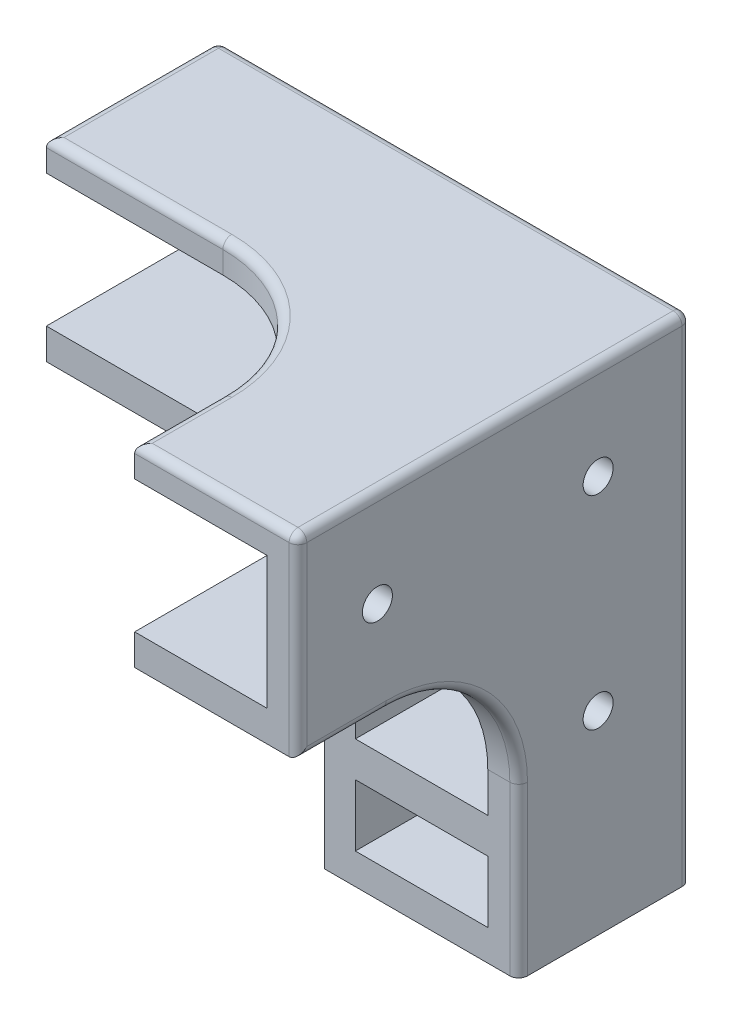
from build123d import *

# Parameters (mm, degrees)
BOSS_EXTRUDE1_DEPTH = 19.5
SKETCH3_W           = 18.5
SKETCH3_H           = 22
BOSS_EXTRUDE2_DEPTH = 25
SKETCH5_W           = 50
SKETCH5_H           = 15
SKETCH5_W_2         = 15
SKETCH5_H_2         = 7
CUT_EXTRUDE1_DEPTH  = 40.5
BOSS_EXTRUDE4_DEPTH = 3.5
BOSS_EXTRUDE5_DEPTH = 3.5
BOSS_EXTRUDE6_DEPTH = 3.5
FILLET3_R           = 3
CUT_EXTRUDE3_DEPTH  = 1
SKETCH12_R          = 1.7
CUT_EXTRUDE4_DEPTH  = 5
SKETCH13_R          = 1.7
CUT_EXTRUDE5_DEPTH  = 45
SKETCH14_R          = 1.7
CUT_EXTRUDE6_DEPTH  = 45
SKETCH15_R          = 1.7
CUT_EXTRUDE7_DEPTH  = 4
FILLET4_R           = 1


with BuildPart() as part:
    # Sketch1 → Boss-Extrude1 (new body)
    with BuildSketch(Plane.XY):
        Polygon((-5.699410772, 32.916253451), (16.300589228, 32.916253451), (16.300589228, -23.083746549), (-5.699410772, -23.083746549), (-5.699410772, 10.916253451), (-37.199410772, 10.916253451), (-37.199410772, 32.916253451), align=None)
    extrude(amount=BOSS_EXTRUDE1_DEPTH)

    # Sketch3 → Boss-Extrude2 (add)
    with BuildSketch(Plane.XY.offset(19.5)):
        with Locations((7.050589228, 21.916253451)):
            Rectangle(SKETCH3_W, SKETCH3_H)
    extrude(amount=BOSS_EXTRUDE2_DEPTH)

    # Sketch5 → Cut-Extrude1 (cut)
    with BuildSketch(Plane.XY.offset(44.5)):
        with Locations((-12.199410772, 21.916253451)):
            Rectangle(SKETCH5_W, SKETCH5_H)
        with Locations((5.300589228, -1.083746549)):
            Rectangle(SKETCH5_W_2, SKETCH5_H)
        with Locations((5.300589228, -16.083746549)):
            Rectangle(SKETCH5_W_2, SKETCH5_H_2)
    extrude(amount=-CUT_EXTRUDE1_DEPTH, mode=Mode.SUBTRACT)

    # Sketch7 → Boss-Extrude4 (add)
    with BuildSketch(Plane(origin=(16.300589228, 0, 0), x_dir=(0, 0, -1), z_dir=(1, 0, 0))):
        with BuildLine():
            Line((-34.5, 10.916253451), (-19.5, 10.916253451))
            Line((-19.5, 10.916253451), (-19.5, -4.083746549))
            ThreePointArc((-19.5, -4.083746549), (-23.893398282, 6.522855169), (-34.5, 10.916253451))
        make_face()
    extrude(amount=-BOSS_EXTRUDE4_DEPTH)

    # Sketch8 → Boss-Extrude5 (add)
    with BuildSketch(Plane(origin=(0, 0, 0), x_dir=(-1, 0, 0), z_dir=(0, 0, -1))):
        with BuildLine():
            Line((5.699410772, 10.916253451), (20.699410772, 10.916253451))
            ThreePointArc((20.699410772, 10.916253451), (10.092809055, 6.522855169), (5.699410772, -4.083746549))
            Line((5.699410772, -4.083746549), (5.699410772, 10.916253451))
        make_face()
    extrude(amount=-BOSS_EXTRUDE5_DEPTH)

    # Sketch9 → Boss-Extrude6 (add)
    with BuildSketch(Plane(origin=(0, 32.916253451, 0), x_dir=(1, 0, 0), z_dir=(0, 1, 0))):
        with BuildLine():
            Line((-2.199410772, -34.5), (-2.199410772, -19.5))
            Line((-2.199410772, -19.5), (-17.199410772, -19.5))
            ThreePointArc((-17.199410772, -19.5), (-6.592809055, -23.893398282), (-2.199410772, -34.5))
        make_face()
    extrude(amount=-BOSS_EXTRUDE6_DEPTH)

    # Fillet3
    fillet3_edges = [part.edges().sort_by_distance(p)[0] for p in [
        (-2.199410772, 12.666253451, 19.5),
    ]]
    fillet(fillet3_edges, radius=FILLET3_R)

    # Sketch11 → Cut-Extrude3 (cut)
    # profile 1 of 4: a face of its own
    with BuildSketch(Plane(origin=(0, 0, 0), x_dir=(-1, 0, 0), z_dir=(0, 0, -1))):
        Polygon((-10.800589228, -18.789996549), (-10.800589228, -16.838073472), (-2.43039692, -14.652977318), (-10.800589228, -12.463073472), (-10.800589228, -10.515958087), (1.199410772, -8.729900395), (1.199410772, -10.602496549), (-6.379916151, -11.729900395), (1.199410772, -13.715477318), (1.199410772, -15.597688857), (-6.379916151, -17.576054241), (1.199410772, -18.703458087), (1.199410772, -20.576054241), align=None)
    # profile 2 of 4: a face of its own
    with BuildSketch(Plane(origin=(0, 0, 0), x_dir=(-1, 0, 0), z_dir=(0, 0, -1))):
        with BuildLine():
            Line((-10.800589228, -7.991438857), (-10.800589228, -5.952977318))
            add(Edge.make_bspline(
                [(-10.800589228, -5.952977318), (-10.800005012, -5.818337024), (-10.798881276, -5.559357226), (-10.780939362, -5.185841664), (-10.756194453, -4.841644627), (-10.717588986, -4.528141475), (-10.670910939, -4.244422827), (-10.610297955, -3.991812577), (-10.542991354, -3.767135176), (-10.432899575, -3.510089545), (-10.261344606, -3.2204116), (-9.993854575, -2.916502166), (-9.674999978, -2.642644015), (-9.298421338, -2.412342144), (-8.876833149, -2.221736808), (-8.412796045, -2.089022583), (-7.914245505, -2.00467731), (-7.569376461, -1.995936272), (-7.391935381, -1.991438857)],
                knots=[0, 0, 0, 0, 1.067446855, 2.053227611, 2.964447842, 3.802928181, 4.55705831, 5.242813606, 5.861740442, 6.41401137, 7.456762865, 8.515266784, 9.610284097, 10.777391769, 12.003071174, 13.267653188, 14.594160368, 16, 16, 16, 16], degree=3))
            add(Edge.make_bspline(
                [(-7.391935381, -1.991438857), (-7.297355032, -1.992855248), (-7.111944506, -1.99563187), (-6.839545611, -2.016474255), (-6.57922187, -2.056818659), (-6.329385024, -2.104637483), (-6.092864844, -2.173393793), (-5.86736032, -2.254741183), (-5.654862929, -2.353204183), (-5.453365078, -2.465039747), (-5.262464902, -2.588608019), (-5.086843378, -2.732896484), (-4.9205107, -2.888692529), (-4.766123648, -3.059365613), (-4.626046251, -3.246963608), (-4.496602326, -3.448494847), (-4.377999142, -3.665222723), (-4.310704173, -3.817832702), (-4.276550766, -3.895285011)],
                knots=[0, 0, 0, 0, 1.163181294, 2.28024169, 3.356120165, 4.401649984, 5.406013808, 6.381787017, 7.347406326, 8.282525473, 9.21452408, 10.139462981, 11.073595085, 12.01554303, 12.965498088, 13.949545959, 14.959357709, 16, 16, 16, 16], degree=3))
            Line((-4.276550766, -3.895285011), (1.199410772, -1.452977318))
            Line((1.199410772, -1.452977318), (1.199410772, -3.541919626))
            Line((1.199410772, -3.541919626), (-4.031358458, -5.873650395))
            Line((-4.031358458, -5.873650395), (-4.031358458, -6.145285011))
            Line((-4.031358458, -6.145285011), (1.199410772, -6.145285011))
            Line((1.199410772, -6.145285011), (1.199410772, -7.991438857))
            Line((1.199410772, -7.991438857), (-10.800589228, -7.991438857))
        make_face()
        with BuildLine():
            Line((-6.185204612, -6.145285011), (-6.185204612, -5.515477318))
            add(Edge.make_bspline(
                [(-6.185204612, -5.515477318), (-6.186367141, -5.438550003), (-6.188596807, -5.291007573), (-6.198784481, -5.078941418), (-6.223636793, -4.886497292), (-6.255016899, -4.712471663), (-6.291026717, -4.555276318), (-6.342625913, -4.418389599), (-6.399049431, -4.298462814), (-6.489896288, -4.166118437), (-6.633796999, -4.027471922), (-6.856716063, -3.91397639), (-7.124487444, -3.84724369), (-7.317795964, -3.840947182), (-7.420781535, -3.837592703)],
                knots=[0, 0, 0, 0, 1.14443165, 2.194958024, 3.155864406, 4.02787753, 4.825710302, 5.549708663, 6.200008757, 6.791751392, 7.929772656, 9.129352395, 10.470655706, 12, 12, 12, 12], degree=3))
            add(Edge.make_bspline(
                [(-7.420781535, -3.837592703), (-7.484265153, -3.839856392), (-7.607360624, -3.844245712), (-7.785755229, -3.879686188), (-7.952879051, -3.933201989), (-8.103735349, -4.014031264), (-8.239800846, -4.109799367), (-8.356212547, -4.223260262), (-8.450592564, -4.353040951), (-8.531146795, -4.502587927), (-8.586059735, -4.694350085), (-8.620716321, -4.939833657), (-8.644326337, -5.246603017), (-8.645891807, -5.472154526), (-8.646743074, -5.594804241)],
                knots=[0, 0, 0, 0, 0.9241003, 1.791841178, 2.640927318, 3.471185814, 4.274581995, 5.058835706, 5.827024317, 6.605084504, 7.520888769, 8.714677486, 10.213517293, 12, 12, 12, 12], degree=3))
            Line((-8.646743074, -5.594804241), (-8.646743074, -6.145285011))
            Line((-8.646743074, -6.145285011), (-6.185204612, -6.145285011))
        make_face(mode=Mode.SUBTRACT)
    # profile 3 of 4: a face of its own
    with BuildSketch(Plane(origin=(0, 0, 0), x_dir=(-1, 0, 0), z_dir=(0, 0, -1))):
        with BuildLine():
            add(Edge.make_bspline(
                [(-1.262127689, -0.176054241), (-1.257647984, -0.104101941), (-1.248753835, 0.038754448), (-1.172545764, 0.242235867), (-1.05033496, 0.427832621), (-0.88404186, 0.590235666), (-0.687299125, 0.730105266), (-0.462023761, 0.828247267), (-0.217504351, 0.891566147), (-0.046993635, 0.897708021), (0.040756926, 0.900868836)],
                knots=[0, 0, 0, 0, 0.919349048, 1.825304879, 2.744940427, 3.746623331, 4.786044724, 5.819977252, 6.878086821, 8, 8, 8, 8], degree=3))
            add(Edge.make_bspline(
                [(0.040756926, 0.900868836), (0.128481887, 0.897613897), (0.299721778, 0.891260229), (0.545324854, 0.828809783), (0.771582895, 0.729449747), (0.970335119, 0.590396057), (1.138671939, 0.427821465), (1.264004419, 0.242957175), (1.339760461, 0.038678283), (1.348736151, -0.104127453), (1.353256926, -0.176054241)],
                knots=[0, 0, 0, 0, 1.117536417, 2.181440851, 3.211339843, 4.255104211, 5.260135653, 6.181815925, 7.084237479, 8, 8, 8, 8], degree=3))
            add(Edge.make_bspline(
                [(1.353256926, -0.176054241), (1.348770157, -0.248001687), (1.339861983, -0.390848436), (1.263364391, -0.595455675), (1.139460356, -0.781986068), (0.970956709, -0.945114294), (0.77080448, -1.081189928), (0.54542444, -1.181069939), (0.299695058, -1.243328016), (0.128472836, -1.249708594), (0.040756926, -1.252977318)],
                knots=[0, 0, 0, 0, 0.915447906, 1.817559426, 2.747445231, 3.752131388, 4.789763433, 5.819308596, 6.882847519, 8, 8, 8, 8], degree=3))
            add(Edge.make_bspline(
                [(0.040756926, -1.252977318), (-0.046984438, -1.249802679), (-0.217477284, -1.243633944), (-0.462123928, -1.180506316), (-0.686511891, -1.081845741), (-0.884668075, -0.944947749), (-1.051117925, -0.781983335), (-1.171904853, -0.594743665), (-1.248854997, -0.390923093), (-1.257681869, -0.248026694), (-1.262127689, -0.176054241)],
                knots=[0, 0, 0, 0, 1.121525552, 2.179269538, 3.212844836, 4.246063491, 5.247400307, 6.175325774, 7.080968592, 8, 8, 8, 8], degree=3))
        make_face()
    # profile 4 of 4: a face of its own
    with BuildSketch(Plane(origin=(0, 0, 0), x_dir=(-1, 0, 0), z_dir=(0, 0, -1))):
        with BuildLine():
            Line((-7.877512305, 3.639330374), (-7.877512305, 1.793176528))
            add(Edge.make_bspline(
                [(-7.877512305, 1.793176528), (-7.985104597, 1.806156245), (-8.194919789, 1.831467926), (-8.50062502, 1.89307865), (-8.789725475, 1.969009097), (-9.063857289, 2.060670567), (-9.32041803, 2.168002956), (-9.560895844, 2.292709709), (-9.787587098, 2.42930416), (-9.925017131, 2.537709574), (-9.99289692, 2.591253451)],
                knots=[0, 0, 0, 0, 1.13409845, 2.211599726, 3.261451197, 4.261463951, 5.235132031, 6.169264622, 7.095758548, 8, 8, 8, 8], degree=3))
            add(Edge.make_bspline(
                [(-9.99289692, 2.591253451), (-10.082013161, 2.667910273), (-10.256359415, 2.817881026), (-10.483761061, 3.07110519), (-10.676767562, 3.337669411), (-10.835123876, 3.619879277), (-10.958228421, 3.915924445), (-11.044683072, 4.227572925), (-11.099664631, 4.553240287), (-11.10537913, 4.776126179), (-11.108281535, 4.889330374)],
                knots=[0, 0, 0, 0, 1.065406432, 2.084352066, 3.078868942, 4.045367136, 5.013203651, 5.979674514, 6.9738726, 8, 8, 8, 8], degree=3))
            add(Edge.make_bspline(
                [(-11.108281535, 4.889330374), (-11.105554752, 4.990429502), (-11.100204953, 5.188780494), (-11.056686246, 5.480236578), (-10.97985421, 5.757907044), (-10.8818086, 6.026068289), (-10.745230943, 6.277428113), (-10.587175591, 6.520140361), (-10.396186865, 6.748620977), (-10.177194209, 6.959885993), (-9.943110555, 7.156839202), (-9.690759412, 7.324416021), (-9.43059281, 7.47074821), (-9.157422302, 7.588703888), (-8.873189212, 7.680392593), (-8.578388089, 7.744054748), (-8.273858918, 7.787935844), (-8.06677444, 7.791411893), (-7.96164692, 7.793176528)],
                knots=[0, 0, 0, 0, 1.018635126, 1.998506719, 2.96030997, 3.918683232, 4.868719089, 5.836268132, 6.834011598, 7.861887245, 8.899958098, 9.91230014, 10.909978245, 11.904579616, 12.905650751, 13.91466998, 14.941371293, 16, 16, 16, 16], degree=3))
            add(Edge.make_bspline(
                [(-7.96164692, 7.793176528), (-7.831571704, 7.7882504), (-7.575267724, 7.778543815), (-7.199658116, 7.710806724), (-6.842854452, 7.593710225), (-6.50564623, 7.43251906), (-6.191993909, 7.228071619), (-5.907939838, 6.979968911), (-5.654954295, 6.689672154), (-5.517272776, 6.469896674), (-5.447223843, 6.358080374)],
                knots=[0, 0, 0, 0, 1.027701034, 2.025011931, 3.004147813, 3.986880317, 4.970346872, 5.953160964, 6.958619193, 8, 8, 8, 8], degree=3))
            add(Edge.make_bspline(
                [(-5.447223843, 6.358080374), (-5.418934484, 6.430798423), (-5.362819656, 6.575042087), (-5.255412748, 6.779194324), (-5.134751997, 6.973329501), (-4.999067172, 7.154540458), (-4.847347238, 7.322970358), (-4.681616094, 7.478791827), (-4.500395305, 7.624150933), (-4.30375287, 7.755244697), (-4.095176448, 7.873355347), (-3.875726079, 7.97347104), (-3.648685489, 8.060719415), (-3.412791492, 8.133216192), (-3.166864793, 8.188590605), (-2.911254324, 8.225884056), (-2.647259211, 8.251365722), (-2.468118928, 8.253589988), (-2.377512305, 8.254714989)],
                knots=[0, 0, 0, 0, 0.971157749, 1.926390409, 2.867917292, 3.816032967, 4.741824403, 5.6878893, 6.646452846, 7.631864642, 8.628382992, 9.628642509, 10.633224323, 11.656081692, 12.699617594, 13.76949873, 14.871843985, 16, 16, 16, 16], degree=3))
            add(Edge.make_bspline(
                [(-2.377512305, 8.254714989), (-2.244325252, 8.252503818), (-1.981850533, 8.248146212), (-1.597044081, 8.197009582), (-1.226862615, 8.122689872), (-0.874542963, 8.009706698), (-0.536107314, 7.870492658), (-0.212201339, 7.699845341), (0.092892066, 7.493753909), (0.380575775, 7.261849568), (0.643411265, 7.006428676), (0.8765742, 6.732895346), (1.069672671, 6.437585756), (1.23223783, 6.128720843), (1.355158488, 5.799574581), (1.443839147, 5.455657192), (1.498563993, 5.093806224), (1.504216675, 4.847057422), (1.50710308, 4.721061143)],
                knots=[0, 0, 0, 0, 1.08934669, 2.146800001, 3.171892192, 4.175766193, 5.1695646, 6.164076811, 7.166278581, 8.178196077, 9.184573215, 10.16196427, 11.113242845, 12.066531174, 13.012937118, 13.981620827, 14.969363733, 16, 16, 16, 16], degree=3))
            add(Edge.make_bspline(
                [(1.50710308, 4.721061143), (1.504031919, 4.602279119), (1.498005885, 4.36921268), (1.44571629, 4.02762683), (1.362713421, 3.702437153), (1.243881772, 3.394298005), (1.091092441, 3.104692046), (0.906771997, 2.829859086), (0.687442467, 2.57259779), (0.434322499, 2.3350891), (0.15282569, 2.119255522), (-0.153407037, 1.926340908), (-0.483775783, 1.75924538), (-0.840338868, 1.624378739), (-1.217591782, 1.506817115), (-1.621739126, 1.421885121), (-2.049128635, 1.361769677), (-2.342880764, 1.341824077), (-2.49289692, 1.331638066)],
                knots=[0, 0, 0, 0, 0.974003266, 1.911126485, 2.827923683, 3.722775623, 4.613731572, 5.50894563, 6.432318302, 7.38099101, 8.351349308, 9.338047726, 10.346428225, 11.382873954, 12.462111462, 13.585146545, 14.766759469, 16, 16, 16, 16], degree=3))
            Line((-2.49289692, 1.331638066), (-2.49289692, 3.177791913))
            add(Edge.make_bspline(
                [(-2.49289692, 3.177791913), (-2.417425318, 3.188945376), (-2.270574462, 3.210647521), (-2.058705359, 3.256683558), (-1.861732034, 3.311165199), (-1.680044741, 3.376135049), (-1.514279405, 3.45120486), (-1.360798784, 3.532148117), (-1.223710633, 3.625749249), (-1.065384613, 3.762941693), (-0.896220111, 3.953356149), (-0.749458771, 4.217045491), (-0.662515335, 4.51137642), (-0.652102457, 4.7164657), (-0.646743074, 4.822022682)],
                knots=[0, 0, 0, 0, 1.004083628, 1.953722164, 2.852062002, 3.692886634, 4.490800013, 5.245942238, 5.974461452, 6.670088602, 8.000762069, 9.303976857, 10.612389357, 12, 12, 12, 12], degree=3))
            add(Edge.make_bspline(
                [(-0.646743074, 4.822022682), (-0.647864371, 4.878202331), (-0.650053976, 4.987906785), (-0.675076379, 5.149181645), (-0.716357012, 5.302683497), (-0.770574005, 5.45033855), (-0.844338553, 5.58810378), (-0.931901508, 5.719433893), (-1.034609515, 5.844770146), (-1.195110626, 5.995917646), (-1.416786421, 6.163242766), (-1.719322479, 6.30573827), (-2.050588673, 6.3928176), (-2.280814454, 6.403216349), (-2.39914692, 6.408561143)],
                knots=[0, 0, 0, 0, 0.766703657, 1.497175717, 2.221804895, 2.935192376, 3.640052165, 4.350243223, 5.088623085, 5.847082799, 7.357237736, 8.859920549, 10.386048059, 12, 12, 12, 12], degree=3))
            add(Edge.make_bspline(
                [(-2.39914692, 6.408561143), (-2.464945748, 6.406711942), (-2.594787133, 6.403062896), (-2.786195597, 6.374088866), (-2.969648465, 6.322755274), (-3.145763747, 6.253440485), (-3.312932079, 6.163011753), (-3.473227413, 6.054384045), (-3.62413007, 5.923172242), (-3.768170684, 5.775714059), (-3.898710135, 5.608114668), (-4.014720541, 5.423570124), (-4.109640596, 5.219059789), (-4.193220285, 4.999736952), (-4.254214347, 4.760765565), (-4.29872396, 4.505093902), (-4.332010414, 4.232310528), (-4.336655471, 4.044084373), (-4.339050766, 3.947022682)],
                knots=[0, 0, 0, 0, 0.899536996, 1.775063972, 2.638995881, 3.499655969, 4.357521698, 5.232774386, 6.141935922, 7.087285127, 8.047315231, 9.041502366, 10.060909586, 11.125312509, 12.246833879, 13.426779274, 14.673079445, 16, 16, 16, 16], degree=3))
            Line((-4.339050766, 3.947022682), (-6.339050766, 3.947022682))
            add(Edge.make_bspline(
                [(-6.339050766, 3.947022682), (-6.351211097, 4.070597942), (-6.374042407, 4.302613426), (-6.427589871, 4.624478183), (-6.497441604, 4.896812425), (-6.588065699, 5.121571579), (-6.694964612, 5.310796304), (-6.816990742, 5.474794656), (-6.9584857, 5.616776513), (-7.116669669, 5.733391795), (-7.285211073, 5.826558536), (-7.45907096, 5.899690982), (-7.641166228, 5.937102036), (-7.763594277, 5.943722311), (-7.824627689, 5.947022682)],
                knots=[0, 0, 0, 0, 1.613490305, 3.029366345, 4.236845818, 5.259854129, 6.169213254, 7.054399038, 7.908596932, 8.76463379, 9.599115534, 10.407455461, 11.206077139, 12, 12, 12, 12], degree=3))
            add(Edge.make_bspline(
                [(-7.824627689, 5.947022682), (-7.902708499, 5.94339984), (-8.054533682, 5.93635536), (-8.271474473, 5.879601033), (-8.4685132, 5.787571995), (-8.638517306, 5.657006158), (-8.780104567, 5.497937744), (-8.882578523, 5.311699797), (-8.945232074, 5.101614866), (-8.951293618, 4.953882443), (-8.954435381, 4.877311143)],
                knots=[0, 0, 0, 0, 1.073009827, 2.08642706, 3.062829201, 4.046239177, 5.014892964, 5.972187552, 6.948963055, 8, 8, 8, 8], degree=3))
            add(Edge.make_bspline(
                [(-8.954435381, 4.877311143), (-8.95071032, 4.808009077), (-8.94335375, 4.671145417), (-8.884755184, 4.47123759), (-8.789639268, 4.281474968), (-8.656940841, 4.105904867), (-8.497545942, 3.947245812), (-8.310497414, 3.816432348), (-8.104113715, 3.708690565), (-7.953735758, 3.662661532), (-7.877512305, 3.639330374)],
                knots=[0, 0, 0, 0, 0.942455657, 1.861242209, 2.81281304, 3.818879151, 4.845099048, 5.862404497, 6.916497371, 8, 8, 8, 8], degree=3))
        make_face()
    extrude(amount=-CUT_EXTRUDE3_DEPTH, mode=Mode.SUBTRACT)

    # Sketch12 → Cut-Extrude4 (cut)
    with BuildSketch(Plane(origin=(0, 0, 0), x_dir=(-1, 0, 0), z_dir=(0, 0, -1))):
        with Locations((-5.300589228, 21.916253451)):
            Circle(SKETCH12_R)
        with Locations((10.949410772, 21.916253451)):
            Circle(SKETCH12_R)
        with Locations((27.199410772, 21.916253451)):
            Circle(SKETCH12_R)
    extrude(amount=-CUT_EXTRUDE4_DEPTH, mode=Mode.SUBTRACT)

    # Sketch13 → Cut-Extrude5 (cut)
    with BuildSketch(Plane.ZY.offset(5.699410772)):
        with Locations(Location((10.5, -1.083746549, 0), (0, 0, 270))):
            Circle(SKETCH13_R)
    extrude(amount=-CUT_EXTRUDE5_DEPTH, mode=Mode.SUBTRACT)

    # Sketch14 → Cut-Extrude6 (cut)
    with BuildSketch(Plane(origin=(16.300589228, 0, 0), x_dir=(0, 0, -1), z_dir=(1, 0, 0))):
        with Locations(Location((-10.5, 21.916253451, 0), (0, 0, 90))):
            Circle(SKETCH14_R)
        with Locations(Location((-35.5, 21.916253451, 0), (0, 0, 90))):
            Circle(SKETCH14_R)
    extrude(amount=-CUT_EXTRUDE6_DEPTH, mode=Mode.SUBTRACT)

    # Sketch15 → Cut-Extrude7 (cut)
    with BuildSketch(Plane.XZ.offset(23.083746549)):
        with Locations(Location((5.300589228, 9.75, 0), (0, 0, 270))):
            Circle(SKETCH15_R)
    extrude(amount=-CUT_EXTRUDE7_DEPTH, mode=Mode.SUBTRACT)

    # Fillet4
    fillet4_edges = [part.edges().sort_by_distance(p)[0] for p in [
        (-5.699410772, -13.583746549, 0),
        (-10.092809055, 6.522855169, 0),
        (-27.199410772, 32.916253451, 19.5),
        (-6.592809055, 32.916253451, 23.893398282),
        (16.300589228, 32.916253451, 22.25),
        (-37.199410772, 32.916253451, 9.75),
        (16.300589228, -13.583746549, 19.5),
        (16.300589228, 10.916253451, 39.5),
        (-2.199410772, 32.916253451, 39.5),
        (16.300589228, 21.916253451, 44.5),
        (7.050589228, 32.916253451, 44.5),
        (-10.449410772, 32.916253451, 0),
        (16.300589228, 4.916253451, 0),
        (-28.949410772, 10.916253451, 0),
        (-37.199410772, 21.916253451, 0),
        (16.300589228, 6.522855169, 23.893398282),
    ]]
    fillet(fillet4_edges, radius=FILLET4_R)


solid = part.part
